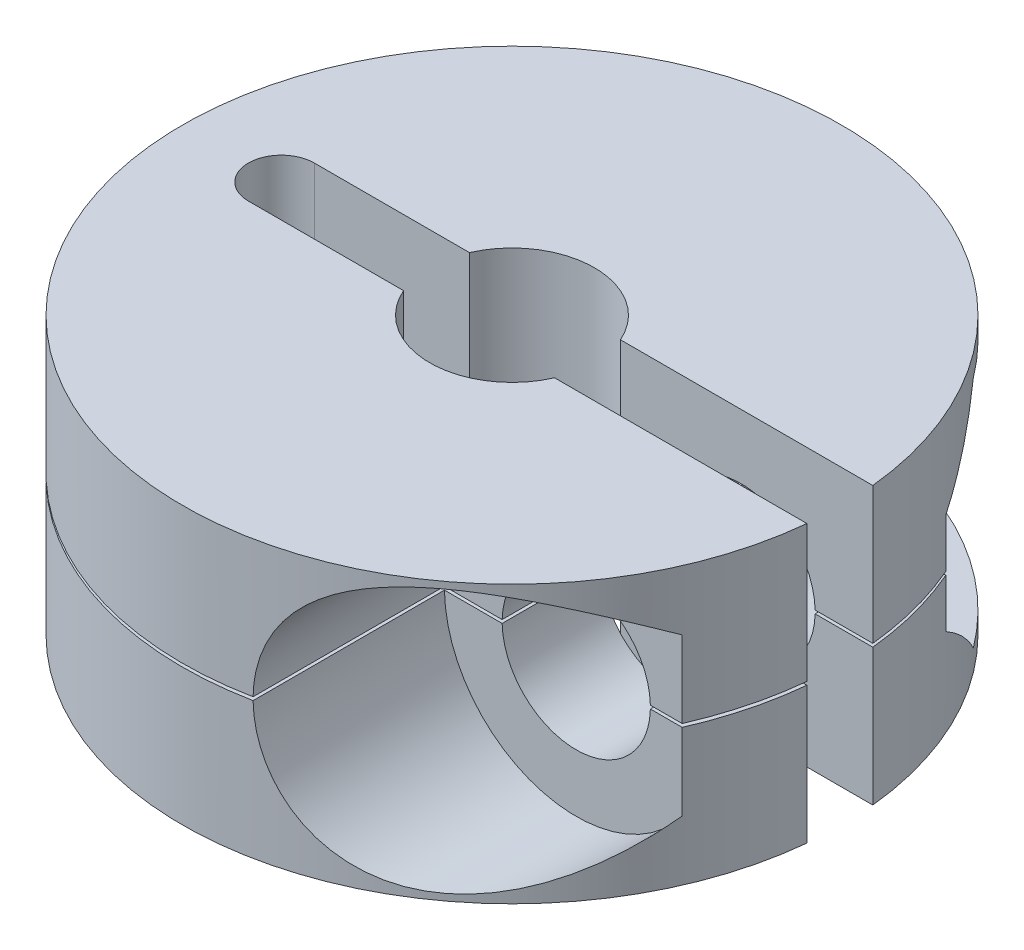
from build123d import *

# Parameters (mm, degrees)
SKETCH1_R               = 10
SKETCH1_R_2             = 2.5
BOSS_EXTRUDE1_DEPTH     = 4.2
CUT_EXTRUDE1_DEPTH      = 17.448708156
CUT_EXTRUDE2_DEPTH      = 16.447977214
CUT_EXTRUDE2_DEPTH_BACK = 10
SKETCH3_R               = 2.25
CUT_EXTRUDE3_START      = 5
CUT_EXTRUDE3_DEPTH      = 10
CUT_EXTRUDE4_START      = 5
SKETCH6_R               = 4
CUT_EXTRUDE4_DEPTH      = 10
SKETCH9_R               = 10
CUT_EXTRUDE5_DEPTH      = 0.05


with BuildPart() as part:
    # Sketch1 → Boss-Extrude1 (new, symmetric)
    with BuildSketch(Plane(origin=(0, 0, 0), x_dir=(1, 0, 0), z_dir=(0, 1, 0))):
        Circle(SKETCH1_R)
        Circle(SKETCH1_R_2, mode=Mode.SUBTRACT)
    extrude(amount=BOSS_EXTRUDE1_DEPTH, both=True)

    # Sketch2 → Cut-Extrude1 (cut, through all)
    with BuildSketch(Plane(origin=(0, 4.2, 0), x_dir=(1, 0, 0), z_dir=(0, 1, 0))):
        with BuildLine():
            Line((-7, 1), (9.949874371, 1))
            ThreePointArc((9.949874371, 1), (10.949874371, 0), (9.949874371, -1))
            Line((9.949874371, -1), (-7, -1))
            ThreePointArc((-7, -1), (-8, 0), (-7, 1))
        make_face()
    extrude(amount=-CUT_EXTRUDE1_DEPTH, mode=Mode.SUBTRACT)

    # Sketch3 → Cut-Extrude2 (cut, two sides: drawn at the far end of the back side and taken through both)
    with BuildSketch(Plane.XY.offset(-1).offset(-CUT_EXTRUDE2_DEPTH_BACK)):
        with Locations((5.949874371, 0)):
            Circle(SKETCH3_R)
    extrude(amount=CUT_EXTRUDE2_DEPTH + CUT_EXTRUDE2_DEPTH_BACK, mode=Mode.SUBTRACT)

    # Sketch4 → Cut-Extrude3 (cut)
    with BuildSketch(Plane(origin=(0, 0, 1), x_dir=(-1, 0, 0), z_dir=(0, 0, -1)).offset(CUT_EXTRUDE3_START)):
        Polygon((-1.85068746, 0), (-3.900280915, 3.55), (-7.999467827, 3.55), (-10.049061282, 0), (-7.999467827, -3.55), (-3.900280915, -3.55), align=None)
    extrude(amount=CUT_EXTRUDE3_DEPTH, mode=Mode.SUBTRACT)

    # Sketch6 → Cut-Extrude4 (cut)
    with BuildSketch(Plane.XY.offset(-1).offset(CUT_EXTRUDE4_START)):
        with Locations((5.949874371, 0)):
            Circle(SKETCH6_R)
    extrude(amount=CUT_EXTRUDE4_DEPTH, mode=Mode.SUBTRACT)

    # Sketch9 → Cut-Extrude5 (cut, symmetric)
    with BuildSketch(Plane(origin=(0, 0, 0), x_dir=(1, 0, 0), z_dir=(0, 1, 0))):
        Circle(SKETCH9_R)
    extrude(amount=CUT_EXTRUDE5_DEPTH, both=True, mode=Mode.SUBTRACT)


with BuildPart() as cut_extrude5_piece_1:
    # of the separate pieces the step leaves, piece 1, a body of its own (cut_extrude5_pieces)
    add(part.part.solids().sort_by_distance((9.949874371, 4.2, -1))[0])


with BuildPart() as cut_extrude5_piece_2:
    # of the separate pieces the step leaves, piece 2, a body of its own (cut_extrude5_pieces)
    add(part.part.solids().sort_by_distance((9.949874371, -0.05, -1))[0])


solid = Compound([cut_extrude5_piece_1.part, cut_extrude5_piece_2.part])
